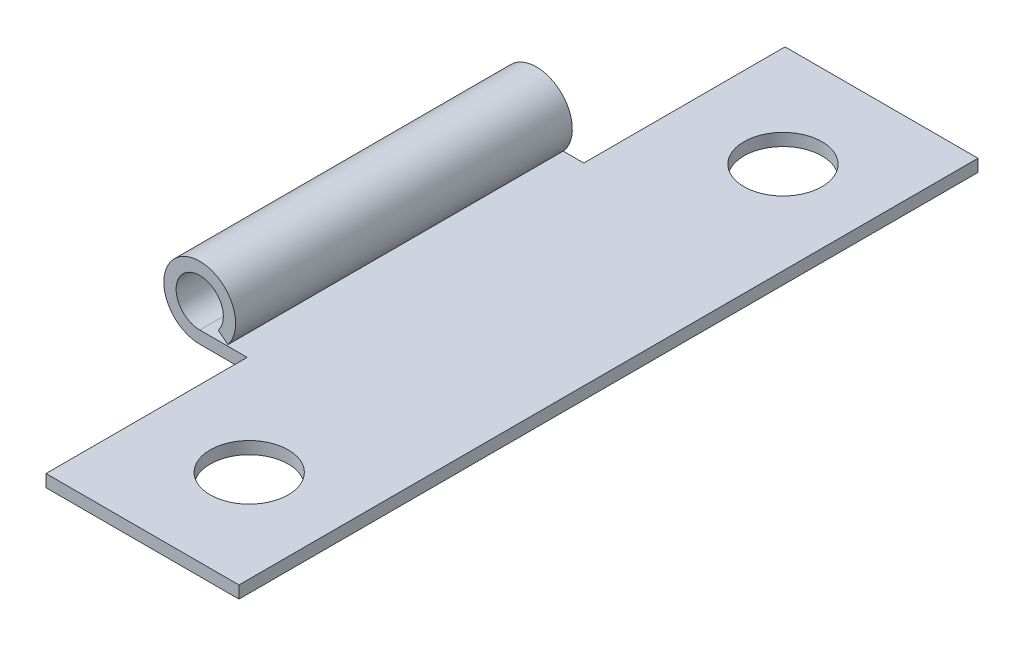
from build123d import *

# Parameters (mm, degrees)
BOSS_EXTRUDE1_DEPTH     = 36
SKETCH2_R               = 1.9
CUT_EXTRUDE1_DEPTH      = 39.543989963
CUT_EXTRUDE2_DEPTH      = 39.543989963
CUT_EXTRUDE2_DEPTH_BACK = 39.543989963
SKETCH3_W               = 6.778348146
SKETCH3_H               = 10.807071142
SKETCH3_W_2             = 8.880524156
SKETCH3_H_2             = 10.732304286


with BuildPart() as part:
    # Sketch1 → Boss-Extrude1 (new body)
    with BuildSketch(Plane.XY):
        with BuildLine():
            Line((0, 0), (0, 0.6))
            Line((0, 0.6), (-11.712138102, 0.6))
            ThreePointArc((-11.712138102, 0.6), (-12.215259426, 2.784102961), (-10.807304622, 1.040227943))
            Line((-10.807304622, 1.040227943), (-10.335217589, 0.669912086))
            ThreePointArc((-10.335217589, 0.669912086), (-12.477757508, 3.32363494), (-11.712138102, 0))
            Line((-11.712138102, 0), (0, 0))
        make_face()
    extrude(amount=BOSS_EXTRUDE1_DEPTH)

    # Sketch2 → Cut-Extrude1 (cut, through all)
    with BuildSketch(Plane(origin=(0, 0.6, 0), x_dir=(1, 0, 0), z_dir=(0, 1, 0))):
        with Locations(Location((-4.5, -5, 0), (0, 0, 180))):
            Circle(SKETCH2_R)
        with Locations(Location((-4.5, -31, 0), (0, 0, 180))):
            Circle(SKETCH2_R)
    extrude(amount=-CUT_EXTRUDE1_DEPTH, mode=Mode.SUBTRACT)

    # Sketch3 → Cut-Extrude2 (cut, two sides: drawn at the far end of the back side and taken through both)
    with BuildSketch(Plane(origin=(0, 0.6, 0), x_dir=(1, 0, 0), z_dir=(0, 1, 0)).offset(-CUT_EXTRUDE2_DEPTH_BACK)):
        with Locations((-12.789174073, -4.396464429)):
            Rectangle(SKETCH3_W, SKETCH3_H)
        with Locations((-13.840262078, -31.566152143)):
            Rectangle(SKETCH3_W_2, SKETCH3_H_2)
    extrude(amount=CUT_EXTRUDE2_DEPTH + CUT_EXTRUDE2_DEPTH_BACK, mode=Mode.SUBTRACT)


solid = part.part
